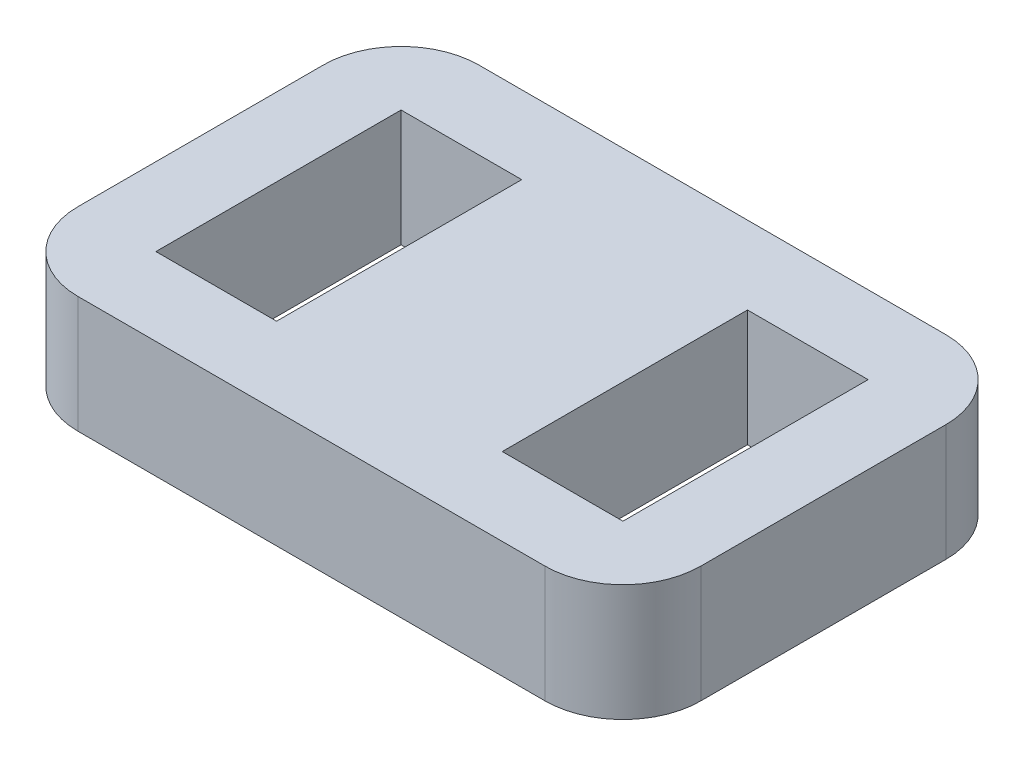
from build123d import *

# Parameters (mm, degrees)
SKETCH1_W           = 3.1
SKETCH1_H           = 6.3
BOSS_EXTRUDE1_DEPTH = 3


with BuildPart() as part:
    # Sketch1 → Boss-Extrude1 (new body)
    with BuildSketch(Plane(origin=(0, 0, 0), x_dir=(1, 0, 0), z_dir=(0, 1, 0))):
        with BuildLine():
            Line((-8, 3.15), (-8, -3.15))
            ThreePointArc((-8, -3.15), (-7.414213562, -4.564213562), (-6, -5.15))
            Line((-6, -5.15), (-2.9, -5.15))
            Line((-2.9, -5.15), (6, -5.15))
            ThreePointArc((6, -5.15), (7.414213562, -4.564213562), (8, -3.15))
            Line((8, -3.15), (8, 3.15))
            ThreePointArc((8, 3.15), (7.414213562, 4.564213562), (6, 5.15))
            Line((6, 5.15), (-2.9, 5.15))
            Line((-2.9, 5.15), (-6, 5.15))
            ThreePointArc((-6, 5.15), (-7.414213562, 4.564213562), (-8, 3.15))
        make_face()
        with Locations((-4.45, 0)):
            Rectangle(SKETCH1_W, SKETCH1_H, mode=Mode.SUBTRACT)
        with Locations((4.45, 0)):
            Rectangle(SKETCH1_W, SKETCH1_H, mode=Mode.SUBTRACT)
    extrude(amount=BOSS_EXTRUDE1_DEPTH)


solid = part.part
